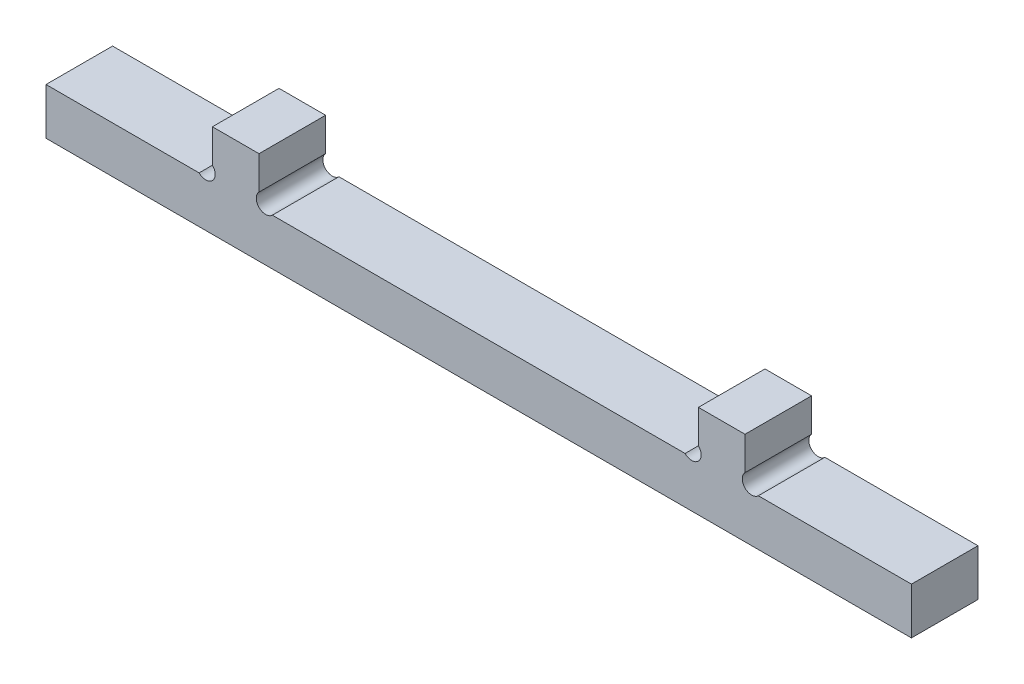
from build123d import *

# Parameters (mm, degrees)
BOSS_EXTRUDE1_DEPTH = 12.7


with BuildPart() as part:
    # Sketch1 → Boss-Extrude1 (new body)
    with BuildSketch(Plane.XY):
        with BuildLine():
            Line((-53.34, 4.445), (-82.55, 4.445))
            Line((-82.55, 4.445), (-82.55, -4.445))
            Line((-82.55, -4.445), (82.55, -4.445))
            Line((82.55, -4.445), (82.55, 4.445))
            Line((82.55, 4.445), (53.34, 4.445))
            ThreePointArc((53.34, 4.445), (50.8, 4.445), (50.8, 6.985))
            Line((50.8, 6.985), (50.8, 13.335))
            Line((50.8, 13.335), (41.91, 13.335))
            Line((41.91, 13.335), (41.91, 6.985))
            ThreePointArc((41.91, 6.985), (41.91, 4.445), (39.37, 4.445))
            Line((39.37, 4.445), (-39.37, 4.445))
            ThreePointArc((-39.37, 4.445), (-41.91, 4.445), (-41.91, 6.985))
            Line((-41.91, 6.985), (-41.91, 13.335))
            Line((-41.91, 13.335), (-50.8, 13.335))
            Line((-50.8, 13.335), (-50.8, 6.985))
            ThreePointArc((-50.8, 6.985), (-50.8, 4.445), (-53.34, 4.445))
        make_face()
    extrude(amount=BOSS_EXTRUDE1_DEPTH)


solid = part.part
